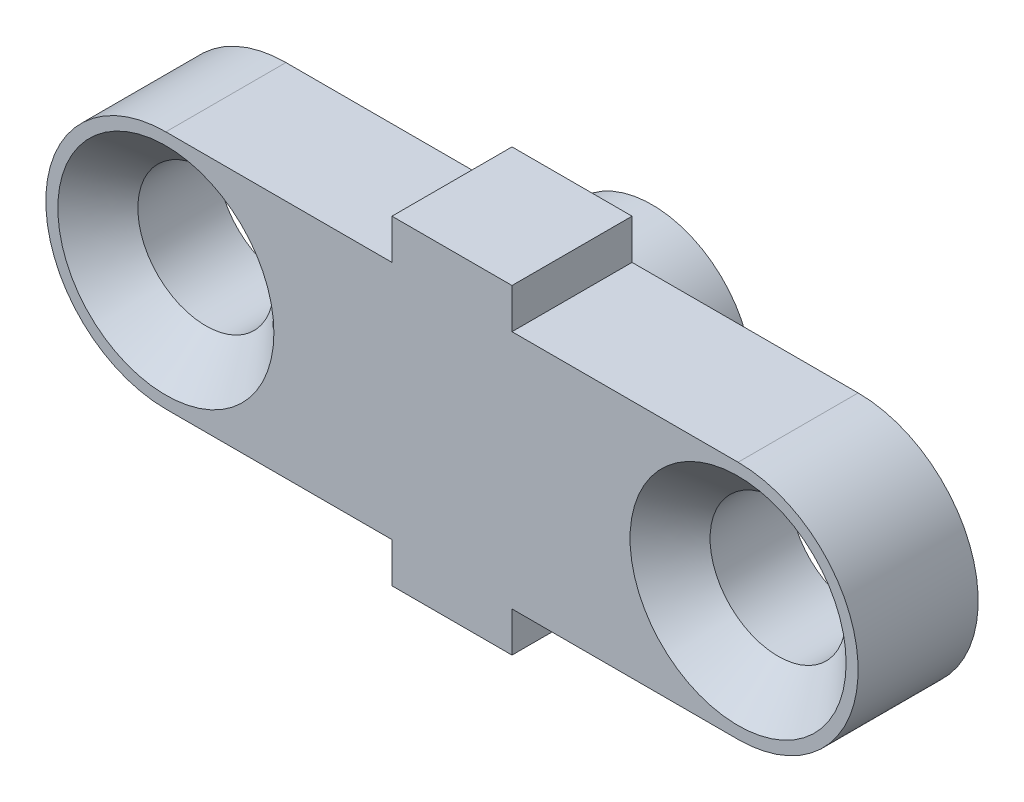
from build123d import *

# Parameters (mm, degrees)
SKETCH1_R           = 1.7
BOSS_EXTRUDE1_DEPTH = 3
CHAMFER1_SIZE       = 1
SKETCH2_R           = 2.5
BOSS_EXTRUDE2_DEPTH = 2


with BuildPart() as part:
    # Sketch1 → Boss-Extrude1 (new body)
    with BuildSketch(Plane.XY):
        with BuildLine():
            Line((-7.15, 3), (-1.5, 3))
            Line((-1.5, 3), (-1.5, 4))
            Line((-1.5, 4), (1.5, 4))
            Line((1.5, 4), (1.5, 3))
            Line((1.5, 3), (7.15, 3))
            ThreePointArc((7.15, 3), (10.15, 0), (7.15, -3))
            Line((7.15, -3), (1.5, -3))
            Line((1.5, -3), (1.5, -4))
            Line((1.5, -4), (-1.5, -4))
            Line((-1.5, -4), (-1.5, -3))
            Line((-1.5, -3), (-7.15, -3))
            ThreePointArc((-7.15, -3), (-10.15, 0), (-7.15, 3))
        make_face()
        with Locations((-7.15, 0)):
            Circle(SKETCH1_R, mode=Mode.SUBTRACT)
        with Locations((7.15, 0)):
            Circle(SKETCH1_R, mode=Mode.SUBTRACT)
    extrude(amount=BOSS_EXTRUDE1_DEPTH)

    # Chamfer1
    chamfer1_edges = [part.edges().sort_by_distance(p)[0] for p in [
        (5.45, 0, 3),
        (-8.85, 0, 3),
    ]]
    chamfer(chamfer1_edges, length=CHAMFER1_SIZE)

    # Sketch2 → Boss-Extrude2 (add)
    with BuildSketch(Plane(origin=(0, 0, 0), x_dir=(-1, 0, 0), z_dir=(0, 0, -1))):
        with Locations(Location((0, 0, 0), (0, 0, 180))):
            Circle(SKETCH2_R)
    extrude(amount=BOSS_EXTRUDE2_DEPTH)


solid = part.part
